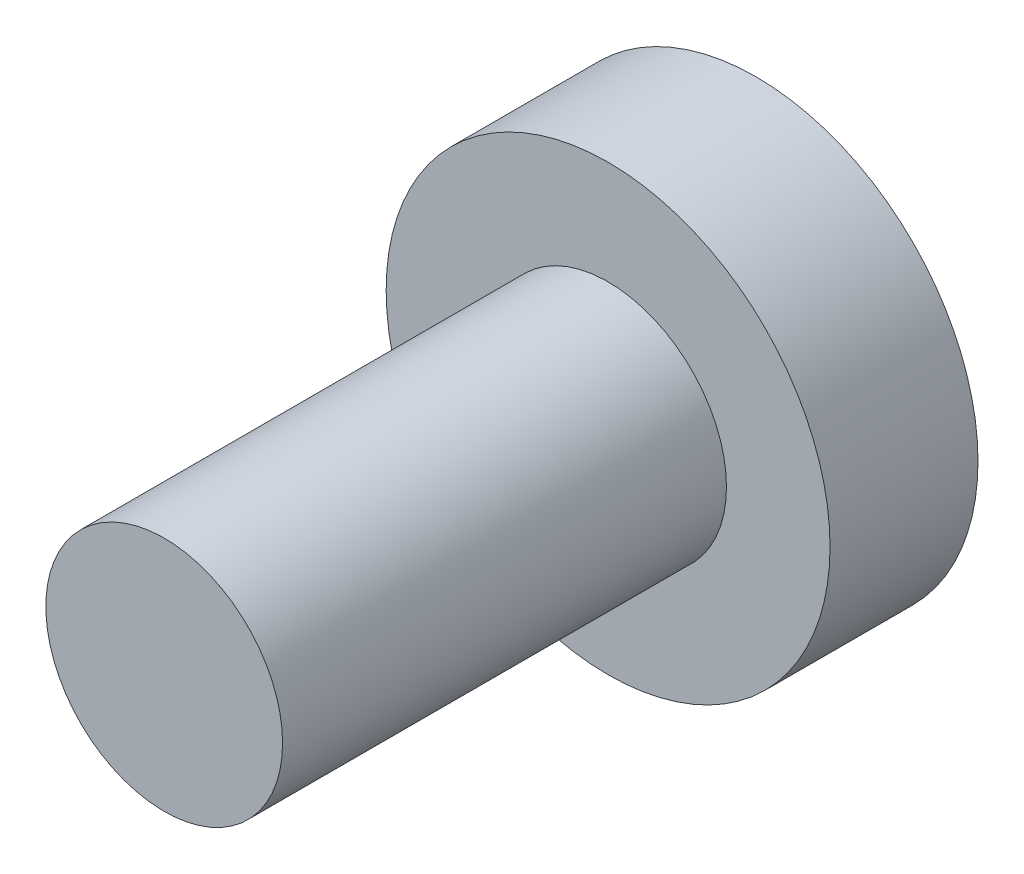
from build123d import *

# Parameters (mm, degrees)
SK_CABEZA_AVELLANADA_R  = 3.75
CABEZA_AVELLANADA_DEPTH = 2.5
SK_CUERPO_R             = 2
CUERPO_DEPTH            = 10
HEXAGONO_INTERIOR_DEPTH = 1.5


with BuildPart() as part:
    # Sk_Cabeza_avellanada → Cabeza_avellanada (new body)
    with BuildSketch(Plane.XY):
        Circle(SK_CABEZA_AVELLANADA_R)
    extrude(amount=CABEZA_AVELLANADA_DEPTH)

    # Sk_Cuerpo → Cuerpo (add)
    with BuildSketch(Plane.XY):
        Circle(SK_CUERPO_R)
    extrude(amount=CUERPO_DEPTH)

    # Sk_Hexagono_interior → Hexagono_interior (cut)
    with BuildSketch(Plane.XY):
        Polygon((0, -1.443375673), (1.25, -0.721687836), (1.25, 0.721687836), (0, 1.443375673), (-1.25, 0.721687836), (-1.25, -0.721687836), align=None)
    extrude(amount=HEXAGONO_INTERIOR_DEPTH, mode=Mode.SUBTRACT)


solid = part.part
